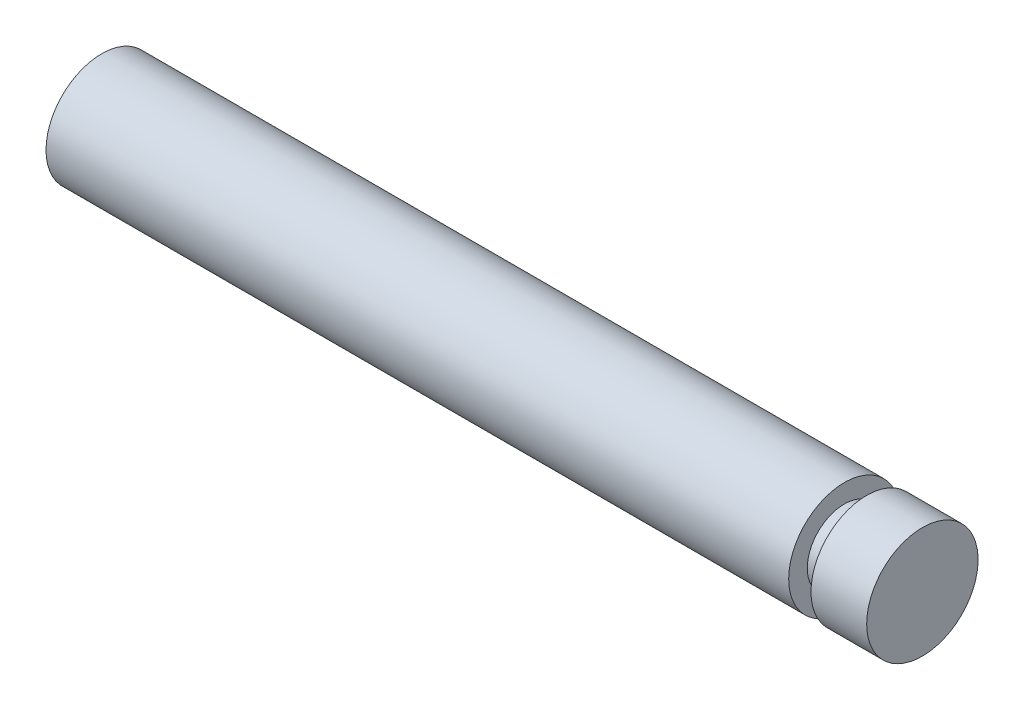
from build123d import *


with BuildPart() as part:
    # Sketch1 → Revolve1 (revolve)
    with BuildSketch(Plane.XY, mode=Mode.PRIVATE) as revolve1_sk:
        Polygon((0, 0), (0, 3), (39.9915, 3), (39.9915, 2), (41.1915, 2), (41.1915, 3), (44.1915, 3), (44.1915, 0), align=None)
    revolve(revolve1_sk.sketch.rotate(Axis((0, 0, 0), (1, 0, 0)), 90), axis=Axis((0, 0, 0), (1, 0, 0)))


solid = part.part
